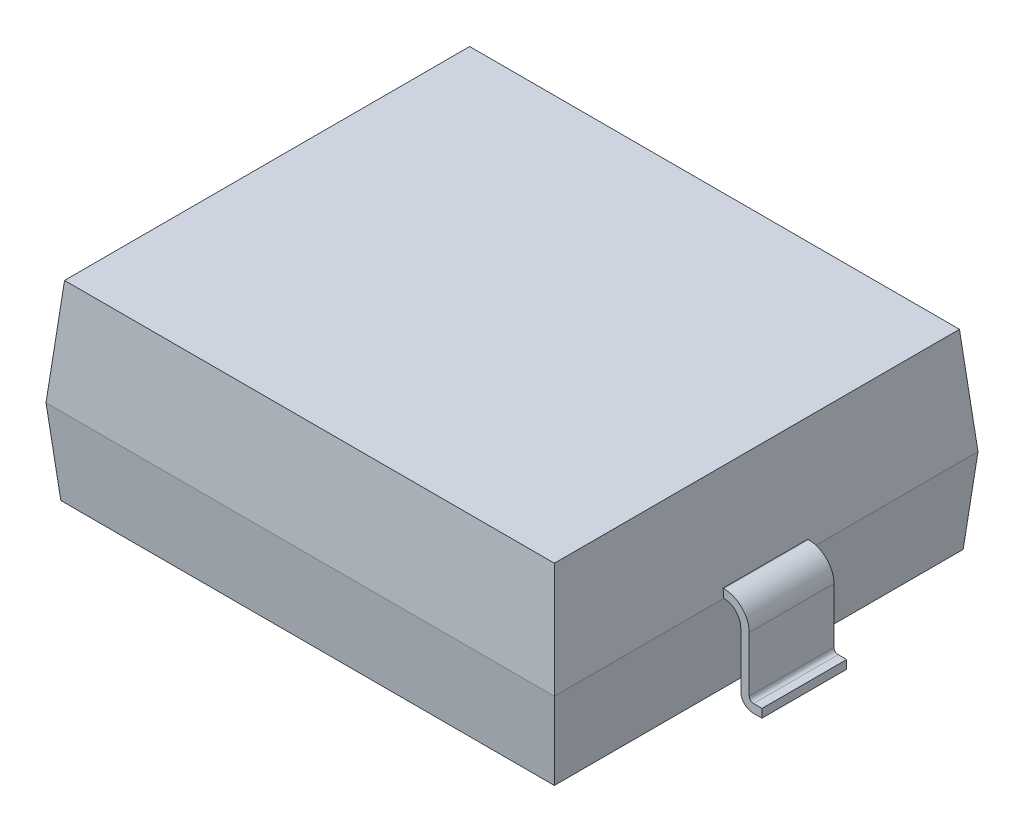
from build123d import *

# Parameters (mm, degrees)
SKETCH1_W                     = 6
SKETCH1_H                     = 5
BOSS_EXTRUDE1_DEPTH           = 1.25
BOSS_EXTRUDE1_TAPER           = 5
BOSS_EXTRUDE1_OTHER_WAY_DEPTH = 1
BOSS_EXTRUDE1_OTHER_WAY_TAPER = 5
EXTRUDE_THIN1_DEPTH           = 0.5
EXTRUDE_THIN1_DEPTH_BACK      = 0.5


with BuildPart() as part:
    # Sketch1 → Boss-Extrude1 (new body)
    with BuildSketch(Plane(origin=(0, 0, 0), x_dir=(1, 0, 0), z_dir=(0, 1, 0))):
        Rectangle(SKETCH1_W, SKETCH1_H)
    extrude(amount=BOSS_EXTRUDE1_DEPTH, taper=BOSS_EXTRUDE1_TAPER)

    # Sketch1 → Boss-Extrude1 other way (add)
    with BuildSketch(Plane(origin=(0, 0, 0), x_dir=(1, 0, 0), z_dir=(0, 1, 0))):
        Rectangle(SKETCH1_W, SKETCH1_H)
    extrude(amount=-BOSS_EXTRUDE1_OTHER_WAY_DEPTH, taper=BOSS_EXTRUDE1_OTHER_WAY_TAPER)


with BuildPart() as body_2:
    # Sketch2 → Extrude-Thin1 (new, two sides: drawn at the far end of the back side and taken through both)
    with BuildSketch(Plane.XY.offset(-EXTRUDE_THIN1_DEPTH_BACK)):
        with BuildLine():
            Line((-1.573017802, 0), (-3, 0))
            ThreePointArc((-3, 0), (-3.141421356, -0.058578644), (-3.2, -0.2))
            Line((-3.2, -0.2), (-3.2, -0.85))
            ThreePointArc((-3.2, -0.85), (-3.243933983, -0.956066017), (-3.35, -1))
            Line((-3.35, -1), (-3.45, -1))
            Line((-3.45, -1), (-3.45, -0.9))
            Line((-3.45, -0.9), (-3.35, -0.9))
            ThreePointArc((-3.35, -0.9), (-3.314644661, -0.885355339), (-3.3, -0.85))
            Line((-3.3, -0.85), (-3.3, -0.2))
            ThreePointArc((-3.3, -0.2), (-3.212132034, 0.012132034), (-3, 0.1))
            Line((-3, 0.1), (-1.573017802, 0.1))
            Line((-1.573017802, 0.1), (-1.573017802, 0))
        make_face()
    extrude(amount=EXTRUDE_THIN1_DEPTH + EXTRUDE_THIN1_DEPTH_BACK)


with BuildPart() as body_3:
    # Mirror3: mirrored copy
    add(body_2.part.mirror(Plane(origin=(0, 0, 0), x_dir=(0, 0, 1), z_dir=(1, 0, 0))))


solid = Compound([part.part, body_2.part, body_3.part])
